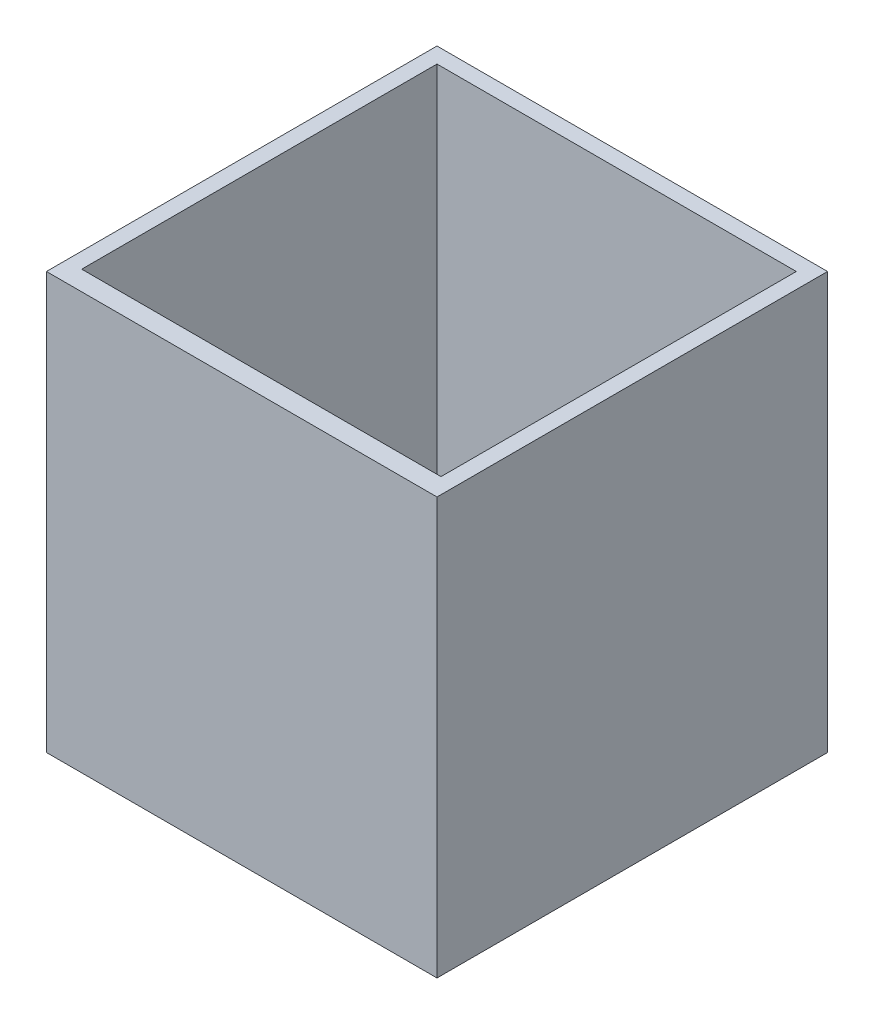
from build123d import *

# Parameters (mm, degrees)
SKETCH1_W           = 75
SKETCH1_H           = 80
BOSS_EXTRUDE1_DEPTH = 75
SKETCH2_W           = 69
SKETCH2_H           = 68.230507762
CUT_EXTRUDE1_DEPTH  = 75
SKETCH3_W           = 7
SKETCH3_H           = 5
CUT_EXTRUDE2_DEPTH  = 75
BOSS_EXTRUDE2_DEPTH = 1.5


with BuildPart() as part:
    # Sketch1 → Boss-Extrude1 (new body)
    with BuildSketch(Plane.XY):
        Rectangle(SKETCH1_W, SKETCH1_H)
    extrude(amount=BOSS_EXTRUDE1_DEPTH)

    # Sketch2 → Cut-Extrude1 (cut)
    with BuildSketch(Plane(origin=(0, 40, 0), x_dir=(1, 0, 0), z_dir=(0, 1, 0))):
        with Locations((0, -37.115253881)):
            Rectangle(SKETCH2_W, SKETCH2_H)
    extrude(amount=-CUT_EXTRUDE1_DEPTH, mode=Mode.SUBTRACT)

    # Sketch3 → Cut-Extrude2 (cut)
    with BuildSketch(Plane(origin=(0, -35, 0), x_dir=(1, 0, 0), z_dir=(0, 1, 0))):
        with Locations((0.817653458, -68.730507762)):
            Rectangle(SKETCH3_W, SKETCH3_H)
    extrude(amount=-CUT_EXTRUDE2_DEPTH, mode=Mode.SUBTRACT)

    # Sketch4 → Boss-Extrude2 (add)
    # profile 1 of 9: a face of its own
    with BuildSketch(Plane.ZY.offset(37.5)):
        with BuildLine():
            Line((24.809186272, 24.93150023), (27.014895407, 24.93150023))
            add(Edge.make_bspline(
                [(27.014895407, 24.93150023), (27.17858287, 24.93083131), (27.494191977, 24.929541552), (27.948048139, 24.911201204), (28.364610884, 24.883531271), (28.743384901, 24.847015312), (29.084686428, 24.796351462), (29.387805706, 24.735519361), (29.654678826, 24.667774341), (29.814721694, 24.604821249), (29.889695087, 24.575330358)],
                knots=[0, 0, 0, 0, 1.348808202, 2.600664361, 3.742342956, 4.788858012, 5.735658768, 6.584006912, 7.336666444, 8, 8, 8, 8], degree=3))
            add(Edge.make_bspline(
                [(29.889695087, 24.575330358), (29.974105485, 24.537265301), (30.139114455, 24.462854138), (30.375562692, 24.336722649), (30.596978062, 24.200844805), (30.799691002, 24.050097565), (30.987979383, 23.890828409), (31.160675648, 23.721522477), (31.316389229, 23.539581448), (31.45675431, 23.348268672), (31.581566331, 23.147831589), (31.688704592, 22.937281786), (31.781345192, 22.718401832), (31.853689821, 22.488809932), (31.913816904, 22.251262077), (31.952704921, 22.004259503), (31.980072472, 21.748635391), (31.982321247, 21.575100031), (31.983465119, 21.486828756)],
                knots=[0, 0, 0, 0, 1.116361014, 2.182309107, 3.229450697, 4.24598407, 5.225421932, 6.201651319, 7.158895679, 8.110002388, 9.060669178, 10.002827475, 10.956240434, 11.923213192, 12.902917952, 13.908279153, 14.936015885, 16, 16, 16, 16], degree=3))
            add(Edge.make_bspline(
                [(31.983465119, 21.486828756), (31.980775019, 21.378204877), (31.975464328, 21.163763753), (31.940763155, 20.847541468), (31.876041156, 20.544093357), (31.788880143, 20.252463529), (31.680894647, 19.970763715), (31.541633221, 19.703895702), (31.38066433, 19.447209641), (31.194761689, 19.204070852), (30.986970728, 18.97224893), (30.74704497, 18.765386858), (30.488257446, 18.569572572), (30.199976801, 18.397934558), (29.890131465, 18.238498128), (29.551654304, 18.103413894), (29.190898003, 17.978751997), (28.937942263, 17.916360453), (28.808465119, 17.88442491)],
                knots=[0, 0, 0, 0, 0.995453645, 1.965186658, 2.910129054, 3.83459069, 4.752398018, 5.669942118, 6.588407184, 7.525617038, 8.471772905, 9.435289717, 10.423772802, 11.441988612, 12.505459691, 13.613754905, 14.778583949, 16, 16, 16, 16], degree=3))
            Line((28.808465119, 17.88442491), (31.739234349, 12.23150023))
            Line((31.739234349, 12.23150023), (29.192619766, 12.23150023))
            Line((29.192619766, 12.23150023), (26.322908228, 17.767397666))
            Line((26.322908228, 17.767397666), (26.106662234, 17.767397666))
            Line((26.106662234, 17.767397666), (25.328176657, 12.23150023))
            Line((25.328176657, 12.23150023), (23.028336913, 12.23150023))
            Line((23.028336913, 12.23150023), (24.809186272, 24.93150023))
        make_face()
        with BuildLine():
            add(Edge.make_bspline(
                [(26.404318484, 19.884064333), (26.568010867, 19.885584304), (26.881113214, 19.888491627), (27.328285258, 19.908714172), (27.73153128, 19.940658446), (28.089688317, 19.9863089), (28.403698511, 20.040296867), (28.672227937, 20.107696988), (28.896507407, 20.187834505), (29.080074381, 20.282869598), (29.228776272, 20.394450068), (29.357484149, 20.513523917), (29.464656611, 20.646813911), (29.553083498, 20.792082386), (29.621284242, 20.949630442), (29.670467522, 21.120525445), (29.697661348, 21.303627936), (29.701841817, 21.429925733), (29.703977939, 21.494460967)],
                knots=[0, 0, 0, 0, 1.892208387, 3.619318591, 5.173427176, 6.566868293, 7.791773198, 8.8545744, 9.763297566, 10.539470204, 11.233547833, 11.906251103, 12.5615143, 13.203742025, 13.866659999, 14.539934446, 15.25394049, 16, 16, 16, 16], degree=3))
            add(Edge.make_bspline(
                [(29.703977939, 21.494460967), (29.701212812, 21.567634605), (29.695848845, 21.70958143), (29.64945272, 21.914025794), (29.570116944, 22.099484599), (29.458621322, 22.264184776), (29.319480779, 22.40940924), (29.149736944, 22.529018337), (28.951329423, 22.623173709), (28.765468903, 22.685379311), (28.58954218, 22.721410388), (28.425544577, 22.745618446), (28.231375993, 22.768978358), (28.006452382, 22.786252277), (27.751044131, 22.797678652), (27.465281277, 22.808781834), (27.149740315, 22.812730188), (26.929244462, 22.814111216), (26.813913837, 22.814833564)],
                knots=[0, 0, 0, 0, 0.974340854, 1.890087692, 2.776057671, 3.647490651, 4.526730822, 5.442477659, 6.397820337, 7.445016909, 8.045730266, 8.789007992, 9.653967296, 10.651691253, 11.794598421, 13.061237498, 14.462876682, 16, 16, 16, 16], degree=3))
            Line((26.813913837, 22.814833564), (26.404318484, 19.884064333))
        make_face(mode=Mode.SUBTRACT)
    # profile 2 of 9: a face of its own
    with BuildSketch(Plane.ZY.offset(37.5)):
        with BuildLine():
            add(Edge.make_bspline(
                [(34.425772811, 14.999448948), (34.523097017, 14.995251364), (34.714587796, 14.986992383), (34.988448186, 14.900646659), (35.242021311, 14.766225423), (35.463900617, 14.578073963), (35.653136165, 14.355835664), (35.793631794, 14.104232109), (35.875014071, 13.825600427), (35.88568105, 13.632963305), (35.891157426, 13.534064333)],
                knots=[0, 0, 0, 0, 1.011829643, 1.990831015, 2.96394547, 3.98733706, 5.003945692, 5.993273531, 6.969756284, 8, 8, 8, 8], degree=3))
            add(Edge.make_bspline(
                [(35.891157426, 13.534064333), (35.885530842, 13.436889253), (35.87447858, 13.246008872), (35.793769757, 12.968863771), (35.652305569, 12.717278172), (35.464973998, 12.492366882), (35.241099753, 12.305345745), (34.989724134, 12.16598332), (34.713862738, 12.085295665), (34.522959518, 12.074285083), (34.425772811, 12.068679717)],
                knots=[0, 0, 0, 0, 1.013694729, 1.991193998, 2.981551723, 4.006008661, 5.030465598, 6.008806002, 6.986305271, 8, 8, 8, 8], degree=3))
            add(Edge.make_bspline(
                [(34.425772811, 12.068679717), (34.327759165, 12.074318408), (34.13523136, 12.085394466), (33.85737434, 12.1653769), (33.605467055, 12.305491406), (33.381523594, 12.491636587), (33.196437919, 12.717445416), (33.058204803, 12.969518183), (32.976925736, 13.245941254), (32.96596711, 13.436866442), (32.960388196, 13.534064333)],
                knots=[0, 0, 0, 0, 1.02155614, 2.006638561, 2.984070978, 4.007577129, 5.025452526, 6.010654007, 6.987246069, 8, 8, 8, 8], degree=3))
            add(Edge.make_bspline(
                [(32.960388196, 13.534064333), (32.965815611, 13.632986624), (32.976387225, 13.825669169), (33.058343065, 14.103578847), (33.195612137, 14.35565588), (33.382599287, 14.578813746), (33.604546732, 14.766075161), (33.858648124, 14.901252718), (34.134509697, 14.986899135), (34.327621868, 14.995219865), (34.425772811, 14.999448948)],
                knots=[0, 0, 0, 0, 1.029295292, 2.004879113, 2.989063463, 3.999073543, 5.021523017, 5.993741641, 6.980301721, 8, 8, 8, 8], degree=3))
        make_face()
    # profile 3 of 9: a face of its own
    with BuildSketch(Plane.ZY.offset(37.5)):
        with BuildLine():
            Line((39.951493965, 24.93150023), (42.124130183, 24.93150023))
            add(Edge.make_bspline(
                [(42.124130183, 24.93150023), (42.282732246, 24.930854284), (42.588174088, 24.929610296), (43.028436906, 24.910961219), (43.433207505, 24.883905122), (43.801486693, 24.846013906), (44.133200822, 24.799886338), (44.427378528, 24.737263053), (44.687725171, 24.670492572), (44.844260991, 24.607401153), (44.917519606, 24.577874429)],
                knots=[0, 0, 0, 0, 1.344208059, 2.588726621, 3.734329264, 4.782131975, 5.726482068, 6.570895881, 7.331180631, 8, 8, 8, 8], degree=3))
            add(Edge.make_bspline(
                [(44.917519606, 24.577874429), (44.999502962, 24.540882543), (45.161097883, 24.467968952), (45.38941606, 24.340422989), (45.601975248, 24.20167886), (45.800772237, 24.054801984), (45.984352443, 23.896567888), (46.153783906, 23.728250216), (46.306037596, 23.54711558), (46.444126718, 23.355937487), (46.565629849, 23.154682016), (46.673585992, 22.946244251), (46.761931422, 22.728598606), (46.837212909, 22.503900639), (46.892316862, 22.268624442), (46.932271895, 22.025522929), (46.959521094, 21.774073661), (46.961795201, 21.603929355), (46.962952298, 21.517357602)],
                knots=[0, 0, 0, 0, 1.101151138, 2.170445781, 3.198860437, 4.208379212, 5.195204417, 6.164605257, 7.130047863, 8.089887807, 9.049952485, 10.006809717, 10.961522665, 11.923831799, 12.906274987, 13.917075149, 14.940179313, 16, 16, 16, 16], degree=3))
            add(Edge.make_bspline(
                [(46.962952298, 21.517357602), (46.96077719, 21.422318647), (46.95645653, 21.233532083), (46.928670985, 20.954482108), (46.880108764, 20.682289278), (46.810337714, 20.417509247), (46.725053084, 20.157370759), (46.616895407, 19.905577665), (46.492742781, 19.659784807), (46.34682305, 19.424801123), (46.188873203, 19.198352204), (46.011887692, 18.989589244), (45.823281801, 18.796645507), (45.624050145, 18.615297277), (45.407478031, 18.454930501), (45.181154973, 18.305462299), (44.939711252, 18.175746649), (44.682065252, 18.058862597), (44.394331355, 17.95808415), (44.069462431, 17.870490446), (43.700733545, 17.794482294), (43.289610343, 17.732405104), (42.834726595, 17.681547543), (42.337355467, 17.645374671), (41.796244446, 17.616106672), (41.421159325, 17.608522018), (41.226073292, 17.604577153)],
                knots=[0, 0, 0, 0, 0.866399648, 1.721027061, 2.553550129, 3.384204618, 4.21539855, 5.04677222, 5.880012857, 6.723270778, 7.566245156, 8.394738354, 9.214784533, 10.025005932, 10.847562629, 11.668810448, 12.495570546, 13.343317016, 14.245569203, 15.271435576, 16.408570332, 17.675782105, 19.060520395, 20.580184572, 22.221315141, 24, 24, 24, 24], degree=3))
            Line((41.226073292, 17.604577153), (40.470484349, 12.23150023))
            Line((40.470484349, 12.23150023), (38.170644606, 12.23150023))
            Line((38.170644606, 12.23150023), (39.951493965, 24.93150023))
        make_face()
        with BuildLine():
            add(Edge.make_bspline(
                [(41.521185471, 19.72124382), (41.67808292, 19.723911514), (41.976741403, 19.728989541), (42.403777605, 19.747518378), (42.788218527, 19.783375749), (43.130781002, 19.829793115), (43.430794509, 19.890813024), (43.689291158, 19.961767546), (43.904133626, 20.050644018), (44.082008539, 20.15081982), (44.223162425, 20.27009958), (44.348266868, 20.39513731), (44.452873774, 20.535615471), (44.536929975, 20.690271146), (44.604155932, 20.856429754), (44.649095816, 21.037152984), (44.677366366, 21.229834952), (44.681403825, 21.362915799), (44.683465119, 21.430859205)],
                knots=[0, 0, 0, 0, 1.839895187, 3.502289619, 5.0101303, 6.365671836, 7.553232357, 8.598057788, 9.502875839, 10.27370316, 10.980290013, 11.662314044, 12.34441055, 13.025273935, 13.721358838, 14.440015487, 15.203561875, 16, 16, 16, 16], degree=3))
            add(Edge.make_bspline(
                [(44.683465119, 21.430859205), (44.680378218, 21.506503922), (44.674359415, 21.653995146), (44.632335842, 21.866051023), (44.555793305, 22.058359646), (44.455091474, 22.232755556), (44.322748213, 22.385062403), (44.162904804, 22.513981226), (43.97389226, 22.616160378), (43.794099767, 22.679140208), (43.627052346, 22.719339622), (43.470339804, 22.743148112), (43.286353831, 22.766399686), (43.074046015, 22.782820183), (42.83495734, 22.798795933), (42.566870091, 22.808470224), (42.270853408, 22.812802685), (42.063921794, 22.814138382), (41.956221529, 22.814833564)],
                knots=[0, 0, 0, 0, 1.03742853, 2.022766538, 2.947121861, 3.864647693, 4.771646501, 5.697975149, 6.666071958, 7.703435297, 8.301453266, 9.020359131, 9.87578453, 10.844509861, 11.939964187, 13.162010635, 14.522931311, 16, 16, 16, 16], degree=3))
            Line((41.956221529, 22.814833564), (41.521185471, 19.72124382))
        make_face(mode=Mode.SUBTRACT)
    # profile 4 of 9: a face of its own
    with BuildSketch(Plane.ZY.offset(37.5)):
        with BuildLine():
            add(Edge.make_bspline(
                [(49.079618965, 14.999448948), (49.17694317, 14.995251364), (49.36843395, 14.986992383), (49.64229434, 14.900646659), (49.895867465, 14.766225423), (50.117746771, 14.578073963), (50.306982319, 14.355835664), (50.447477947, 14.104232109), (50.528860225, 13.825600427), (50.539527204, 13.632963305), (50.54500358, 13.534064333)],
                knots=[0, 0, 0, 0, 1.011829643, 1.990831015, 2.96394547, 3.98733706, 5.003945692, 5.993273531, 6.969756284, 8, 8, 8, 8], degree=3))
            add(Edge.make_bspline(
                [(50.54500358, 13.534064333), (50.539376996, 13.436889253), (50.528324734, 13.246008872), (50.447615911, 12.968863771), (50.306151723, 12.717278172), (50.118820152, 12.492366882), (49.894945907, 12.305345745), (49.643570288, 12.16598332), (49.367708891, 12.085295665), (49.176805672, 12.074285083), (49.079618965, 12.068679717)],
                knots=[0, 0, 0, 0, 1.013694729, 1.991193998, 2.981551723, 4.006008661, 5.030465598, 6.008806002, 6.986305271, 8, 8, 8, 8], degree=3))
            add(Edge.make_bspline(
                [(49.079618965, 12.068679717), (48.981605319, 12.074318408), (48.789077514, 12.085394466), (48.511220494, 12.1653769), (48.259313209, 12.305491406), (48.035369747, 12.491636587), (47.850284073, 12.717445416), (47.712050957, 12.969518183), (47.63077189, 13.245941254), (47.619813264, 13.436866442), (47.614234349, 13.534064333)],
                knots=[0, 0, 0, 0, 1.02155614, 2.006638561, 2.984070978, 4.007577129, 5.025452526, 6.010654007, 6.987246069, 8, 8, 8, 8], degree=3))
            add(Edge.make_bspline(
                [(47.614234349, 13.534064333), (47.619661765, 13.632986624), (47.630233379, 13.825669169), (47.712189219, 14.103578847), (47.849458291, 14.35565588), (48.036445441, 14.578813746), (48.258392886, 14.766075161), (48.512494278, 14.901252718), (48.788355851, 14.986899135), (48.981468022, 14.995219865), (49.079618965, 14.999448948)],
                knots=[0, 0, 0, 0, 1.029295292, 2.004879113, 2.989063463, 3.999073543, 5.021523017, 5.993741641, 6.980301721, 8, 8, 8, 8], degree=3))
        make_face()
    # profile 5 of 9: a face of its own
    with BuildSketch(Plane.ZY.offset(37.5)):
        with BuildLine():
            Line((21.392499574, 0.347966576), (19.626914638, -1.191196084))
            add(Edge.make_bspline(
                [(19.626914638, -1.191196084), (19.538674891, -1.071997794), (19.369565043, -0.843556467), (19.101222416, -0.537155091), (18.844140326, -0.270895988), (18.585184447, -0.058565791), (18.332776196, 0.109799764), (18.084716031, 0.231760325), (17.839609584, 0.308829831), (17.676113472, 0.318050039), (17.596746369, 0.322525871)],
                knots=[0, 0, 0, 0, 1.358515141, 2.603569235, 3.730126198, 4.746094498, 5.666493297, 6.504166865, 7.273866877, 8, 8, 8, 8], degree=3))
            add(Edge.make_bspline(
                [(17.596746369, 0.322525871), (17.521777361, 0.319280238), (17.377601967, 0.313038453), (17.17064778, 0.259823332), (16.982553455, 0.17422353), (16.821066943, 0.050392864), (16.686193603, -0.092378774), (16.58604832, -0.252595188), (16.527725004, -0.429188987), (16.51964055, -0.551365668), (16.515516401, -0.613692078)],
                knots=[0, 0, 0, 0, 1.130304997, 2.173727141, 3.204821236, 4.229135679, 5.225705988, 6.15679035, 7.05971714, 8, 8, 8, 8], degree=3))
            add(Edge.make_bspline(
                [(16.515516401, -0.613692078), (16.519272355, -0.675092364), (16.527172259, -0.804235702), (16.585051117, -1.00001504), (16.672600543, -1.206298471), (16.777903757, -1.385662182), (16.896136584, -1.548530026), (17.02003718, -1.707894988), (17.181818467, -1.898435393), (17.378678978, -2.122332772), (17.60873801, -2.381476238), (17.877962544, -2.672095217), (18.181505083, -2.996098371), (18.39710518, -3.222377791), (18.510067683, -3.340935667)],
                knots=[0, 0, 0, 0, 0.642317819, 1.35098826, 2.122816345, 2.986294386, 3.520967692, 4.229638134, 5.099348126, 6.137609051, 7.351336444, 8.727500291, 10.285391505, 12, 12, 12, 12], degree=3))
            add(Edge.make_bspline(
                [(18.510067683, -3.340935667), (18.571346947, -3.404326024), (18.688929947, -3.5259598), (18.853914475, -3.70360195), (19.001166557, -3.868242489), (19.137122849, -4.014115118), (19.253510136, -4.148751709), (19.35288292, -4.268922128), (19.437244413, -4.372935406), (19.487119811, -4.438176876), (19.509887394, -4.467958904)],
                knots=[0, 0, 0, 0, 1.403722598, 2.693470914, 3.859630393, 4.920438112, 5.867965235, 6.69256451, 7.40316977, 8, 8, 8, 8], degree=3))
            add(Edge.make_bspline(
                [(19.509887394, -4.467958904), (19.600549312, -4.593209451), (19.775409124, -4.834780418), (20.002215287, -5.20207116), (20.189809298, -5.555948757), (20.337220423, -5.900601311), (20.44749369, -6.23979848), (20.527361328, -6.579147196), (20.577671597, -6.921470153), (20.583251549, -7.151786278), (20.586029221, -7.266436469)],
                knots=[0, 0, 0, 0, 1.215130546, 2.343624586, 3.390252636, 4.360992906, 5.286454858, 6.190345157, 7.099163061, 8, 8, 8, 8], degree=3))
            add(Edge.make_bspline(
                [(20.586029221, -7.266436469), (20.58257273, -7.392978074), (20.575770339, -7.642012587), (20.523060161, -8.007393016), (20.440959991, -8.357734257), (20.318536182, -8.690931518), (20.167372664, -9.010610569), (19.975514034, -9.312090244), (19.754805357, -9.600471565), (19.500009859, -9.868941643), (19.221132097, -10.114456303), (18.91746505, -10.327063816), (18.596489243, -10.508283535), (18.254941779, -10.657476054), (17.893863447, -10.770949196), (17.513898395, -10.851658918), (17.115748044, -10.905233743), (16.84303379, -10.909772094), (16.703777619, -10.912089513)],
                knots=[0, 0, 0, 0, 1.018989505, 2.005376454, 2.968035412, 3.912365187, 4.859556873, 5.811049809, 6.78527381, 7.780773345, 8.787785161, 9.773320145, 10.761314359, 11.752515283, 12.770107012, 13.804505292, 14.878913802, 16, 16, 16, 16], degree=3))
            add(Edge.make_bspline(
                [(16.703777619, -10.912089513), (16.596870187, -10.909947412), (16.38523699, -10.905706923), (16.071557853, -10.877552197), (15.765484315, -10.829488417), (15.467466163, -10.760128815), (15.176881132, -10.673523495), (14.893276191, -10.569568661), (14.617360962, -10.443743451), (14.348782091, -10.299319701), (14.087514752, -10.135732571), (13.835126645, -9.951030791), (13.588894671, -9.748776159), (13.352046139, -9.525138138), (13.119580346, -9.286289915), (12.895568893, -9.026797964), (12.682262699, -8.745574692), (12.546855664, -8.549184462), (12.478076497, -8.449429257)],
                knots=[0, 0, 0, 0, 1.003438088, 1.986398949, 2.953471805, 3.909242729, 4.856156023, 5.798037682, 6.742035895, 7.700024963, 8.658509928, 9.632892881, 10.633707184, 11.647385023, 12.688779161, 13.761077638, 14.862753205, 16, 16, 16, 16], degree=3))
            Line((12.478076497, -8.449429257), (14.358144606, -6.971324289))
            add(Edge.make_bspline(
                [(14.358144606, -6.971324289), (14.451788011, -7.115313061), (14.63139011, -7.391474372), (14.924133244, -7.764243205), (15.222583648, -8.081055134), (15.527824986, -8.340678351), (15.840839283, -8.542685192), (16.159379618, -8.687081303), (16.484863663, -8.779956659), (16.705726473, -8.790281199), (16.815716721, -8.795422847)],
                knots=[0, 0, 0, 0, 1.289844872, 2.473840458, 3.555310637, 4.554525788, 5.477014656, 6.343795492, 7.175205895, 8, 8, 8, 8], degree=3))
            add(Edge.make_bspline(
                [(16.815716721, -8.795422847), (16.917201685, -8.790975237), (17.114761369, -8.782317124), (17.397369574, -8.701704116), (17.65665189, -8.577433942), (17.881122762, -8.399995657), (18.070223743, -8.19160624), (18.207683266, -7.954206075), (18.290437265, -7.694093087), (18.301093161, -7.51381153), (18.306542042, -7.42162477)],
                knots=[0, 0, 0, 0, 1.07813582, 2.098795369, 3.104167493, 4.120866408, 5.124778177, 6.083335831, 7.019916046, 8, 8, 8, 8], degree=3))
            add(Edge.make_bspline(
                [(18.306542042, -7.42162477), (18.303938978, -7.346695343), (18.298643866, -7.194275074), (18.243447374, -6.967261777), (18.161526649, -6.737071321), (18.062236327, -6.542525598), (17.955145275, -6.371934592), (17.841734797, -6.217452353), (17.699031897, -6.036126345), (17.522488349, -5.832212619), (17.319320741, -5.598827054), (17.081831034, -5.344171895), (16.817607149, -5.059819855), (16.627892076, -4.865267421), (16.528236753, -4.763071084)],
                knots=[0, 0, 0, 0, 0.82235112, 1.672813781, 2.554588539, 3.50524042, 4.06657461, 4.767804758, 5.610876414, 6.602916144, 7.732569792, 9.01260869, 10.430754915, 12, 12, 12, 12], degree=3))
            add(Edge.make_bspline(
                [(16.528236753, -4.763071084), (16.4227617, -4.653981856), (16.218861557, -4.443094935), (15.930397459, -4.134463328), (15.670559872, -3.847205753), (15.439643011, -3.581019946), (15.237456131, -3.335427409), (15.060500695, -3.112291264), (14.914132613, -2.908668013), (14.83158192, -2.776552388), (14.793180663, -2.715094321)],
                knots=[0, 0, 0, 0, 1.354401886, 2.618275412, 3.770529779, 4.811580489, 5.763301005, 6.60974666, 7.35327647, 8, 8, 8, 8], degree=3))
            add(Edge.make_bspline(
                [(14.793180663, -2.715094321), (14.707437975, -2.561950146), (14.541082356, -2.264824008), (14.369582047, -1.797175267), (14.257822026, -1.33553458), (14.243212216, -1.027284317), (14.236029221, -0.87573134)],
                knots=[0, 0, 0, 0, 1.081804801, 2.098888081, 3.065307629, 4, 4, 4, 4], degree=3))
            add(Edge.make_bspline(
                [(14.236029221, -0.87573134), (14.238608396, -0.778091377), (14.243738857, -0.58386725), (14.280674218, -0.29721799), (14.337227946, -0.016918885), (14.427383914, 0.252778415), (14.53135975, 0.518627144), (14.667269076, 0.773641856), (14.819963702, 1.024683268), (14.942465887, 1.180197616), (15.004338516, 1.25874382)],
                knots=[0, 0, 0, 0, 1.012167245, 2.013389743, 2.992947912, 3.971795425, 4.958040075, 5.949133471, 6.964161297, 8, 8, 8, 8], degree=3))
            add(Edge.make_bspline(
                [(15.004338516, 1.25874382), (15.086015745, 1.35340713), (15.247112678, 1.540117293), (15.525840953, 1.778785946), (15.821370427, 1.984941364), (16.140062534, 2.150442613), (16.478252585, 2.282349031), (16.839157016, 2.37185637), (17.22000991, 2.430331136), (17.481189733, 2.436197183), (17.614554862, 2.439192538)],
                knots=[0, 0, 0, 0, 1.010152455, 1.992384693, 2.959065588, 3.919519142, 4.890305168, 5.888624478, 6.921877408, 8, 8, 8, 8], degree=3))
            add(Edge.make_bspline(
                [(17.614554862, 2.439192538), (17.798978423, 2.432754038), (18.162780884, 2.420053156), (18.697988293, 2.321335897), (19.208009723, 2.154001708), (19.697945979, 1.926651051), (20.159842067, 1.627243375), (20.599866764, 1.265314677), (21.017777254, 0.838285217), (21.26526492, 0.514451248), (21.392499574, 0.347966576)],
                knots=[0, 0, 0, 0, 0.984438778, 1.941949542, 2.894274057, 3.844399604, 4.817935388, 5.825099055, 6.88187249, 8, 8, 8, 8], degree=3))
        make_face()
    # profile 6 of 9: a face of its own
    with BuildSketch(Plane.ZY.offset(37.5)):
        Polygon((24.157904221, 2.113551512), (26.457743965, 2.113551512), (24.676894606, -10.586448488), (22.377054862, -10.586448488), align=None)
    # profile 7 of 9: a face of its own
    with BuildSketch(Plane.ZY.offset(37.5)):
        Polygon((29.027255183, 2.113551512), (31.166818484, 2.113551512), (35.646926657, -6.521023808), (36.857904221, 2.113551512), (39.157743965, 2.113551512), (37.379438676, -10.586448488), (35.257683869, -10.586448488), (30.762311272, -1.857742558), (29.541157426, -10.586448488), (27.241317683, -10.586448488), align=None)
    # profile 8 of 9: a face of its own
    with BuildSketch(Plane.ZY.offset(37.5)):
        with BuildLine():
            Line((52.936429862, -0.201552654), (50.913893804, -1.46849977))
            add(Edge.make_bspline(
                [(50.913893804, -1.46849977), (50.770445845, -1.311805931), (50.496408085, -1.012463724), (50.06657873, -0.6210785), (49.643162186, -0.305881964), (49.219600261, -0.065927034), (48.786253591, 0.112268567), (48.331016113, 0.232157935), (47.849149117, 0.308399199), (47.518703491, 0.317744774), (47.349651016, 0.322525871)],
                knots=[0, 0, 0, 0, 1.232977487, 2.355435308, 3.369770187, 4.291348691, 5.174604885, 6.082334442, 7.018942652, 8, 8, 8, 8], degree=3))
            add(Edge.make_bspline(
                [(47.349651016, 0.322525871), (47.166095335, 0.317660535), (46.805343192, 0.308098419), (46.279185477, 0.217612498), (45.777856676, 0.079221367), (45.303501873, -0.121229595), (44.855834431, -0.380604463), (44.434317224, -0.695682161), (44.038655518, -1.0667683), (43.805296801, -1.34958803), (43.686189478, -1.493940475)],
                knots=[0, 0, 0, 0, 1.037106879, 2.038283569, 3.009830787, 3.972569298, 4.94146214, 5.928319872, 6.942605276, 8, 8, 8, 8], degree=3))
            add(Edge.make_bspline(
                [(43.686189478, -1.493940475), (43.596715004, -1.614609576), (43.419962438, -1.852985644), (43.19434478, -2.232348156), (42.999929661, -2.618663045), (42.840553884, -3.015796264), (42.718606573, -3.422969963), (42.632479059, -3.84098655), (42.576806031, -4.268021209), (42.570146282, -4.556830219), (42.566798452, -4.702013392)],
                knots=[0, 0, 0, 0, 1.040960542, 2.056368018, 3.055559505, 4.03710588, 5.019268411, 5.998275661, 6.99374091, 8, 8, 8, 8], degree=3))
            add(Edge.make_bspline(
                [(42.566798452, -4.702013392), (42.57022422, -4.84377992), (42.57697773, -5.123256367), (42.630183033, -5.533520003), (42.723940379, -5.92532073), (42.846879278, -6.301635196), (43.011510633, -6.659052792), (43.210781619, -6.999181885), (43.446324689, -7.321101099), (43.715205607, -7.622127319), (44.009408185, -7.896965702), (44.32350916, -8.137858374), (44.654444569, -8.340620223), (45.002347106, -8.506653786), (45.367000241, -8.637337559), (45.749298067, -8.727966508), (46.147048433, -8.786281529), (46.418313642, -8.792346604), (46.555901016, -8.795422847)],
                knots=[0, 0, 0, 0, 1.066897471, 2.103265977, 3.106535126, 4.095591644, 5.078159493, 6.062322472, 7.058152725, 8.075375883, 9.096057735, 10.084186963, 11.049730852, 12.011871914, 12.980953841, 13.959387168, 14.96498868, 16, 16, 16, 16], degree=3))
            add(Edge.make_bspline(
                [(46.555901016, -8.795422847), (46.659434863, -8.79350463), (46.864414296, -8.789706886), (47.167923392, -8.758285937), (47.464544606, -8.70725048), (47.75388347, -8.636723606), (48.03590937, -8.543989888), (48.311216945, -8.431583511), (48.580565382, -8.300241592), (48.840953895, -8.146095692), (49.092799625, -7.974102946), (49.33254224, -7.779958798), (49.559644354, -7.564866555), (49.775926488, -7.329959016), (49.98280129, -7.07648871), (50.172891221, -6.799160013), (50.354684955, -6.504092734), (50.463953934, -6.296130399), (50.519562875, -6.190294642)],
                knots=[0, 0, 0, 0, 0.990751711, 1.961520103, 2.916931976, 3.869720035, 4.809138875, 5.755683625, 6.713987145, 7.674487982, 8.649319602, 9.630449541, 10.623757948, 11.640402946, 12.684918653, 13.752145235, 14.856026455, 16, 16, 16, 16], degree=3))
            Line((50.519562875, -6.190294642), (46.510107747, -6.190294642))
            Line((46.510107747, -6.190294642), (46.800131785, -4.073627975))
            Line((46.800131785, -4.073627975), (53.312952298, -4.073627975))
            add(Edge.make_bspline(
                [(53.312952298, -4.073627975), (53.296661523, -4.329279113), (53.264804241, -4.829215478), (53.14951533, -5.557182357), (52.978767854, -6.243706915), (52.757439491, -6.891434291), (52.483295695, -7.499156373), (52.152075872, -8.065225954), (51.77026986, -8.591771339), (51.334409225, -9.071889912), (50.857140081, -9.502693725), (50.34738513, -9.883297086), (49.801273928, -10.199001425), (49.226086398, -10.459792196), (48.619558746, -10.66490735), (47.98014889, -10.808706548), (47.308902637, -10.897343633), (46.850443392, -10.907113768), (46.616958708, -10.912089513)],
                knots=[0, 0, 0, 0, 1.148955532, 2.246830018, 3.301660101, 4.319666133, 5.314146826, 6.287838685, 7.257462643, 8.227280698, 9.191724348, 10.138440807, 11.076252923, 12.016254752, 12.968042649, 13.943717582, 14.952773983, 16, 16, 16, 16], degree=3))
            add(Edge.make_bspline(
                [(46.616958708, -10.912089513), (46.488867528, -10.910819365), (46.235814772, -10.9083101), (45.862155634, -10.882532827), (45.498995886, -10.83852392), (45.146563741, -10.780717604), (44.803305371, -10.706832744), (44.470985596, -10.615847259), (44.148833286, -10.506478292), (43.838864016, -10.376896381), (43.534477446, -10.240173811), (43.245121068, -10.077298941), (42.963681021, -9.902473868), (42.694582452, -9.708143064), (42.433768995, -9.499471424), (42.185191577, -9.273120413), (41.946675104, -9.029986724), (41.797573256, -8.857310682), (41.722167042, -8.769982142)],
                knots=[0, 0, 0, 0, 1.111499042, 2.195841241, 3.24834816, 4.285223882, 5.294222847, 6.294054786, 7.273859608, 8.244193736, 9.208986092, 10.167555097, 11.123181443, 12.083077344, 13.046240314, 14.020501641, 14.998895854, 16, 16, 16, 16], degree=3))
            add(Edge.make_bspline(
                [(41.722167042, -8.769982142), (41.607545134, -8.625222425), (41.379967903, -8.337807775), (41.087819069, -7.87470123), (40.838505814, -7.391728927), (40.638852351, -6.886423245), (40.47923827, -6.362684072), (40.367817254, -5.817633208), (40.300783912, -5.252369542), (40.291839426, -4.868408979), (40.287311272, -4.674028616)],
                knots=[0, 0, 0, 0, 0.999328569, 1.984127054, 2.959716786, 3.938705326, 4.922250225, 5.921072174, 6.947541011, 8, 8, 8, 8], degree=3))
            add(Edge.make_bspline(
                [(40.287311272, -4.674028616), (40.293393604, -4.436206522), (40.305395532, -3.966925288), (40.40888162, -3.276971863), (40.569849472, -2.610264154), (40.804064286, -1.970140894), (41.09972553, -1.352969375), (41.464975346, -0.763485051), (41.890966953, -0.195129755), (42.38142024, 0.336623818), (42.913294995, 0.828067325), (43.478062636, 1.259750988), (44.070276414, 1.623111173), (44.685104594, 1.924016407), (45.328415969, 2.152806011), (45.994556259, 2.318389367), (46.686707321, 2.420997329), (47.156795341, 2.433065769), (47.395444285, 2.439192538)],
                knots=[0, 0, 0, 0, 1.022519879, 2.01768214, 2.99445506, 3.968403767, 4.944092992, 5.933246428, 6.946641619, 7.994936793, 9.040543676, 10.058341478, 11.047494914, 12.024771785, 12.997483176, 13.978673844, 14.973836105, 16, 16, 16, 16], degree=3))
            add(Edge.make_bspline(
                [(47.395444285, 2.439192538), (47.574559123, 2.436289808), (47.931220657, 2.430509762), (48.46138268, 2.367902041), (48.985780993, 2.275893443), (49.499336327, 2.139645335), (49.998675166, 1.973476582), (50.477015632, 1.774552326), (50.929742993, 1.543504088), (51.36021162, 1.278024185), (51.772695837, 0.975065468), (52.174992732, 0.629000344), (52.565842954, 0.234829943), (52.81112153, -0.053996509), (52.936429862, -0.201552654)],
                knots=[0, 0, 0, 0, 1.014010841, 2.019144067, 3.019687909, 4.027399918, 5.025300219, 5.998481464, 6.958680332, 7.901091373, 8.859847597, 9.854378501, 10.903841272, 12, 12, 12, 12], degree=3))
        make_face()
    # profile 9 of 9: a face of its own
    with BuildSketch(Plane.ZY.offset(37.5)):
        Polygon((56.884827298, 2.113551512), (59.184667042, 2.113551512), (58.500312074, -2.771063872), (62.715836913, -2.771063872), (63.397647811, 2.113551512), (65.697487554, 2.113551512), (63.916638196, -10.586448488), (61.616798452, -10.586448488), (62.415636593, -4.887730539), (58.202655824, -4.887730539), (57.403817683, -10.586448488), (55.103977939, -10.586448488), align=None)
    extrude(amount=BOSS_EXTRUDE2_DEPTH)


solid = part.part
